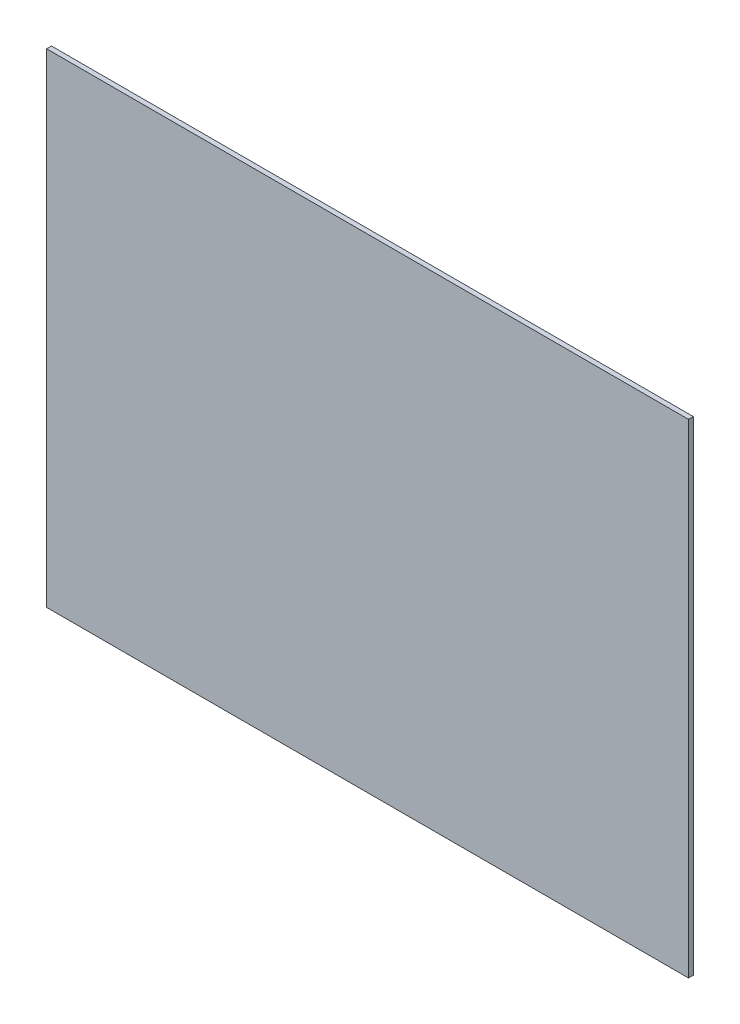
from build123d import *

# Parameters (mm, degrees)
CROQUIS1_W              = 398
CROQUIS1_H              = 300
SALIENTE_EXTRUIR1_DEPTH = 3


with BuildPart() as part:
    # Croquis1 → Saliente-Extruir1 (new body)
    with BuildSketch(Plane.XY):
        Rectangle(CROQUIS1_W, CROQUIS1_H)
    extrude(amount=SALIENTE_EXTRUIR1_DEPTH)


solid = part.part
